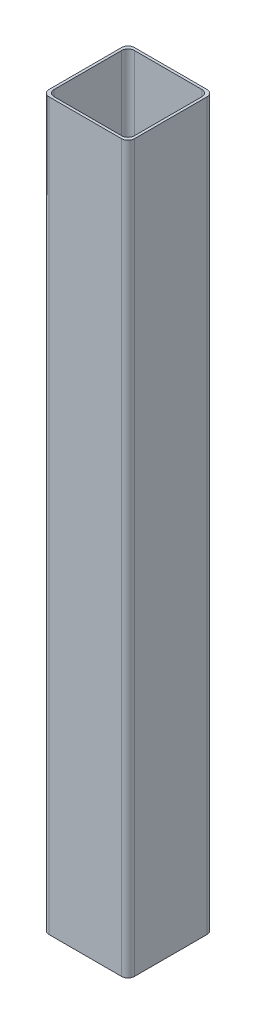
from build123d import *

# Parameters (mm, degrees)
ESBO_O1_W                = 40
ESBO_O1_H                = 40
ESBO_O1_W_2              = 37.6
ESBO_O1_H_2              = 37.6
RESSALTO_EXTRUS_O1_DEPTH = 170
FILETE1_R                = 3


with BuildPart() as part:
    # Esboço1 → Ressalto-extrusão1 (new, symmetric)
    with BuildSketch(Plane(origin=(0, 0, 0), x_dir=(1, 0, 0), z_dir=(0, 1, 0))):
        Rectangle(ESBO_O1_W, ESBO_O1_H)
        Rectangle(ESBO_O1_W_2, ESBO_O1_H_2, mode=Mode.SUBTRACT)
    extrude(amount=RESSALTO_EXTRUS_O1_DEPTH, both=True)

    # Filete1
    filete1_edges = [part.edges().sort_by_distance(p)[0] for p in [
        (-18.8, 0, 18.8),
        (18.8, 0, 18.8),
        (18.8, 0, -18.8),
        (-18.8, 0, -18.8),
        (-20, 0, -20),
        (20, 0, -20),
        (20, 0, 20),
        (-20, 0, 20),
    ]]
    fillet(filete1_edges, radius=FILETE1_R)


solid = part.part
